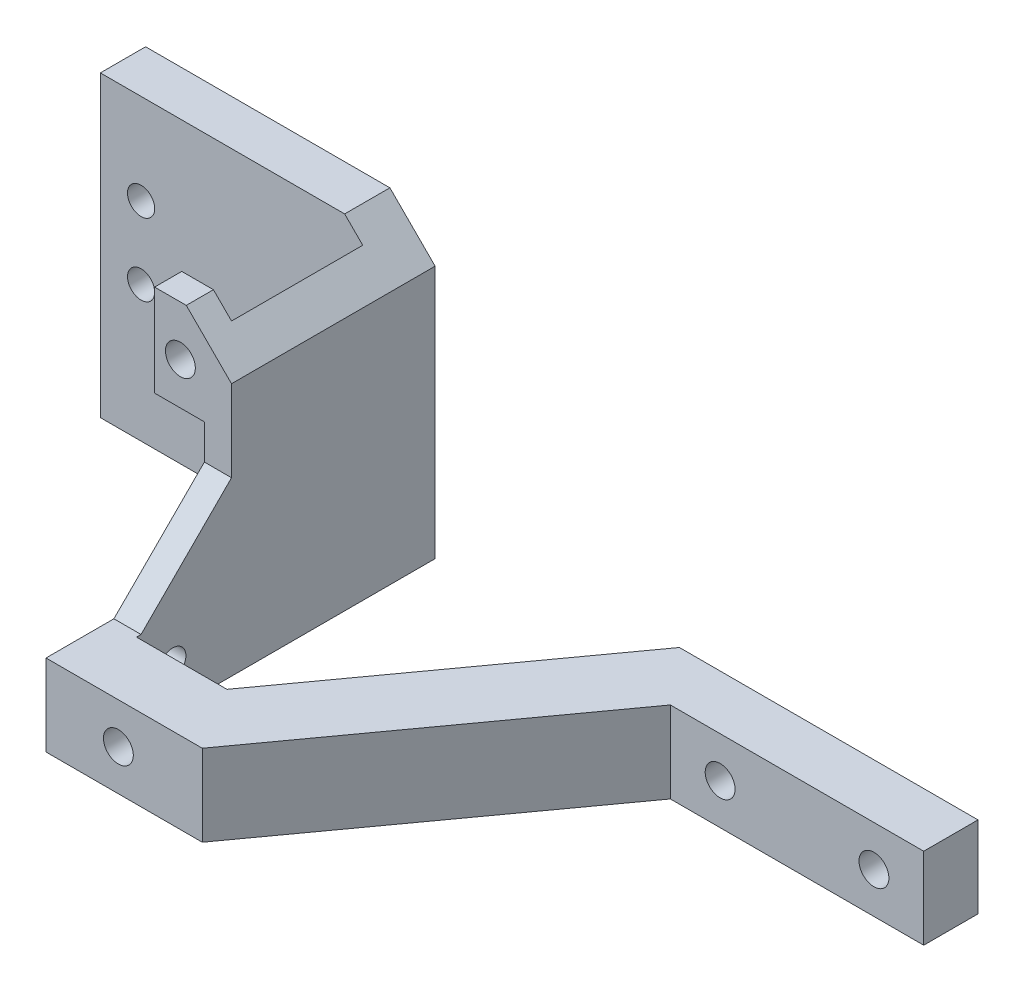
from build123d import *

# Parameters (mm, degrees)
SZKIC1_W                    = 28
SZKIC1_H                    = 9
SZKIC1_R                    = 1.65
DODANIE_WYCI_GNI_CIE1_DEPTH = 6
DODANIE_WYCI_GNI_CIE2_DEPTH = 9
SZKIC3_W                    = 3
SZKIC3_H                    = 40.009031977
DODANIE_WYCI_GNI_CIE3_DEPTH = 9
SZKIC10_R                   = 1.65
WYTNIJ_WYCI_GNI_CIE4_DEPTH  = 7
SZKIC11_W                   = 32
SZKIC11_H                   = 33
SZKIC11_R                   = 1.5
DODANIE_WYCI_GNI_CIE4_DEPTH = 5
SZKIC12_W                   = 3
SZKIC12_H                   = 17.504515989
DODANIE_WYCI_GNI_CIE5_DEPTH = 24
SZKIC13_W                   = 10
SZKIC13_H                   = 3
DODANIE_WYCI_GNI_CIE6_DEPTH = 33
SZKIC14_R                   = 1.65
WYTNIJ_WYCI_GNI_CIE5_DEPTH  = 3
SZKIC15_W                   = 7
SZKIC15_H                   = 22.85
WYTNIJ_WYCI_GNI_CIE6_DEPTH  = 3
SFAZOWANIE1_SIZE            = 10
SZKIC16_R                   = 1.5
WYTNIJ_WYCI_GNI_CIE7_DEPTH  = 5
SZKIC17_R                   = 1.46285789
WYTNIJ_WYCI_GNI_CIE8_DEPTH  = 3
SZKIC18_W                   = 3
SZKIC18_H                   = 10.15
WYTNIJ_WYCI_GNI_CIE9_DEPTH  = 1.5
WYTNIJ_WYCI_GNI_CIE10_REACH = 87.52


with BuildPart() as part:
    # Szkic1 → Dodanie-wyciągnięcie1 (new body)
    with BuildSketch(Plane.XY):
        with Locations((14, 4.5)):
            Rectangle(SZKIC1_W, SZKIC1_H)
        with Locations((5.5, 4.5)):
            Circle(SZKIC1_R, mode=Mode.SUBTRACT)
        with Locations((22.5, 4.5)):
            Circle(SZKIC1_R, mode=Mode.SUBTRACT)
    extrude(amount=DODANIE_WYCI_GNI_CIE1_DEPTH)

    # Szkic2 → Dodanie-wyciągnięcie2 (add)
    with BuildSketch(Plane.XZ):
        Polygon((0, 0), (-5, 0), (-26, 29.009031977), (-36, 29.009031977), (-36, 36.009031977), (-21.72391247, 36.009031977), (0, 6), align=None)
    extrude(amount=-DODANIE_WYCI_GNI_CIE2_DEPTH)

    # Szkic3 → Dodanie-wyciągnięcie3 (add)
    with BuildSketch(Plane.XZ):
        with Locations((-37.5, 16.004515988)):
            Rectangle(SZKIC3_W, SZKIC3_H)
    extrude(amount=-DODANIE_WYCI_GNI_CIE3_DEPTH)

    # Szkic10 → Wytnij-wyciągnięcie4 (cut)
    with BuildSketch(Plane.XY.offset(36.009031977)):
        with Locations((-31, 4.5)):
            Circle(SZKIC10_R)
    extrude(amount=-WYTNIJ_WYCI_GNI_CIE4_DEPTH, mode=Mode.SUBTRACT)

    # Szkic11 → Dodanie-wyciągnięcie4 (add)
    with BuildSketch(Plane(origin=(0, 0, -4), x_dir=(-1, 0, 0), z_dir=(0, 0, -1))):
        with Locations((52, 16.5)):
            Rectangle(SZKIC11_W, SZKIC11_H)
        with Locations((63.5, 15)):
            Circle(SZKIC11_R, mode=Mode.SUBTRACT)
    extrude(amount=-DODANIE_WYCI_GNI_CIE4_DEPTH)

    # Szkic12 → Dodanie-wyciągnięcie5 (add)
    with BuildSketch(Plane(origin=(0, 9, 0), x_dir=(1, 0, 0), z_dir=(0, 1, 0))):
        with Locations((-37.5, -9.752257995)):
            Rectangle(SZKIC12_W, SZKIC12_H)
    extrude(amount=DODANIE_WYCI_GNI_CIE5_DEPTH)

    # Szkic13 → Dodanie-wyciągnięcie6 (add)
    with BuildSketch(Plane(origin=(0, 33, 0), x_dir=(1, 0, 0), z_dir=(0, 1, 0))):
        with Locations((-41, -17.004515989)):
            Rectangle(SZKIC13_W, SZKIC13_H)
    extrude(amount=-DODANIE_WYCI_GNI_CIE6_DEPTH)

    # Szkic14 → Wytnij-wyciągnięcie5 (cut)
    with BuildSketch(Plane.XY.offset(18.504515989)):
        with Locations((-41.65, 27.5)):
            Circle(SZKIC14_R)
    extrude(amount=-WYTNIJ_WYCI_GNI_CIE5_DEPTH, mode=Mode.SUBTRACT)

    # Szkic15 → Wytnij-wyciągnięcie6 (cut)
    with BuildSketch(Plane.XY.offset(18.504515989)):
        with Locations((-42.5, 11.425)):
            Rectangle(SZKIC15_W, SZKIC15_H)
    extrude(amount=-WYTNIJ_WYCI_GNI_CIE6_DEPTH, mode=Mode.SUBTRACT)

    # Sfazowanie1
    sfazowanie1_edges = [part.edges().sort_by_distance(p)[0] for p in [
        (-37.5, 9, 18.504515989),
    ]]
    chamfer(sfazowanie1_edges, length=SFAZOWANIE1_SIZE)

    # Szkic16 → Wytnij-wyciągnięcie7 (cut)
    with BuildSketch(Plane.XY.offset(1)):
        with Locations((-63.5, 23)):
            Circle(SZKIC16_R)
    extrude(amount=-WYTNIJ_WYCI_GNI_CIE7_DEPTH, mode=Mode.SUBTRACT)

    # Szkic17 → Wytnij-wyciągnięcie8 (cut)
    with BuildSketch(Plane.ZY.offset(39)):
        with Locations((25.009031977, 4.5)):
            Circle(SZKIC17_R)
    extrude(amount=-WYTNIJ_WYCI_GNI_CIE8_DEPTH, mode=Mode.SUBTRACT)

    # Szkic18 → Wytnij-wyciągnięcie9 (cut)
    with BuildSketch(Plane.ZY.offset(46)):
        with Locations((17.004515989, 27.925)):
            Rectangle(SZKIC18_W, SZKIC18_H)
    extrude(amount=-WYTNIJ_WYCI_GNI_CIE9_DEPTH, mode=Mode.SUBTRACT)

    # Wytnij-wyciągnięcie10: up to this face of the body (flat: up to its plane)
    wytnij_wyci_gni_cie10_end = Plane(part.part.faces().sort_by_distance((-39.760074004, 27.060059494, 18.504515989))[0])
    # Szkic19 → Wytnij-wyciągnięcie10 (cut, up to the picked face)
    with BuildSketch(Plane(origin=(0, 0, -4), x_dir=(-1, 0, 0), z_dir=(0, 0, -1)), mode=Mode.PRIVATE) as wytnij_wyci_gni_cie10_sk1:
        Polygon((36, 28), (41, 33), (36, 33), align=None)
    wytnij_wyci_gni_cie10_tool1 = split(extrude(wytnij_wyci_gni_cie10_sk1.sketch, amount=-WYTNIJ_WYCI_GNI_CIE10_REACH, mode=Mode.PRIVATE), bisect_by=wytnij_wyci_gni_cie10_end, keep=Keep.BOTH, mode=Mode.PRIVATE)
    add(wytnij_wyci_gni_cie10_tool1.solids().sort_by(Axis((-37.666667, 31.333333, -4), (0, 0, 1)))[0], mode=Mode.SUBTRACT)


solid = part.part
